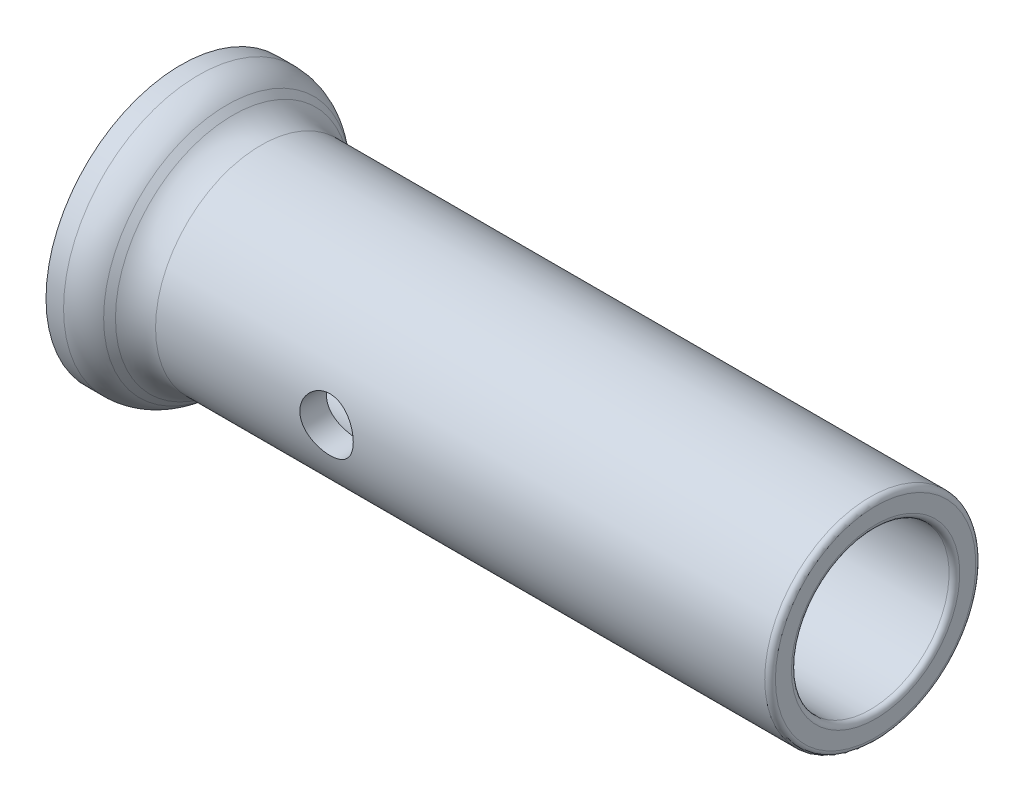
from build123d import *

# Parameters (mm, degrees)
ESQUISSE4_W = 1
ESQUISSE4_H = 5.05


with BuildPart() as part:
    # Esquisse1 → Révolution1 (revolve)
    with BuildSketch(Plane.XY, mode=Mode.PRIVATE) as r_volution1_sk:
        with BuildLine():
            Line((0, 4.05), (0, 5.05))
            Line((0, 5.05), (0.657359313, 5.05))
            ThreePointArc((0.657359313, 5.05), (1.231384461, 4.935819299), (1.718019485, 4.610660172))
            Line((1.718019485, 4.610660172), (1.939339828, 4.389339828))
            ThreePointArc((1.939339828, 4.389339828), (2.425974851, 4.064180701), (3, 3.95))
            Line((3, 3.95), (25.8, 3.95))
            ThreePointArc((25.8, 3.95), (25.941421356, 3.891421356), (26, 3.75))
            Line((26, 3.75), (26, 3.15))
            ThreePointArc((26, 3.15), (25.941421356, 3.008578644), (25.8, 2.95))
            Line((25.8, 2.95), (1, 2.95))
            Line((1, 2.95), (1, 4.05))
            Line((1, 4.05), (0, 4.05))
        make_face()
    revolve(r_volution1_sk.sketch.rotate(Axis((-11.300588411, 0, 0), (1, 0, 0)), 90), axis=Axis((-11.300588411, 0, 0), (1, 0, 0)))

    # Esquisse4 → Dégagement M21 (revolve, cut)
    with BuildSketch(Plane.YZ.offset(9.4)):
        with Locations((0.5, 2.525)):
            Rectangle(ESQUISSE4_W, ESQUISSE4_H)
    revolve(axis=Axis((9.4, 0, -6.35), (0, 0, 1)), mode=Mode.SUBTRACT)


solid = part.part
